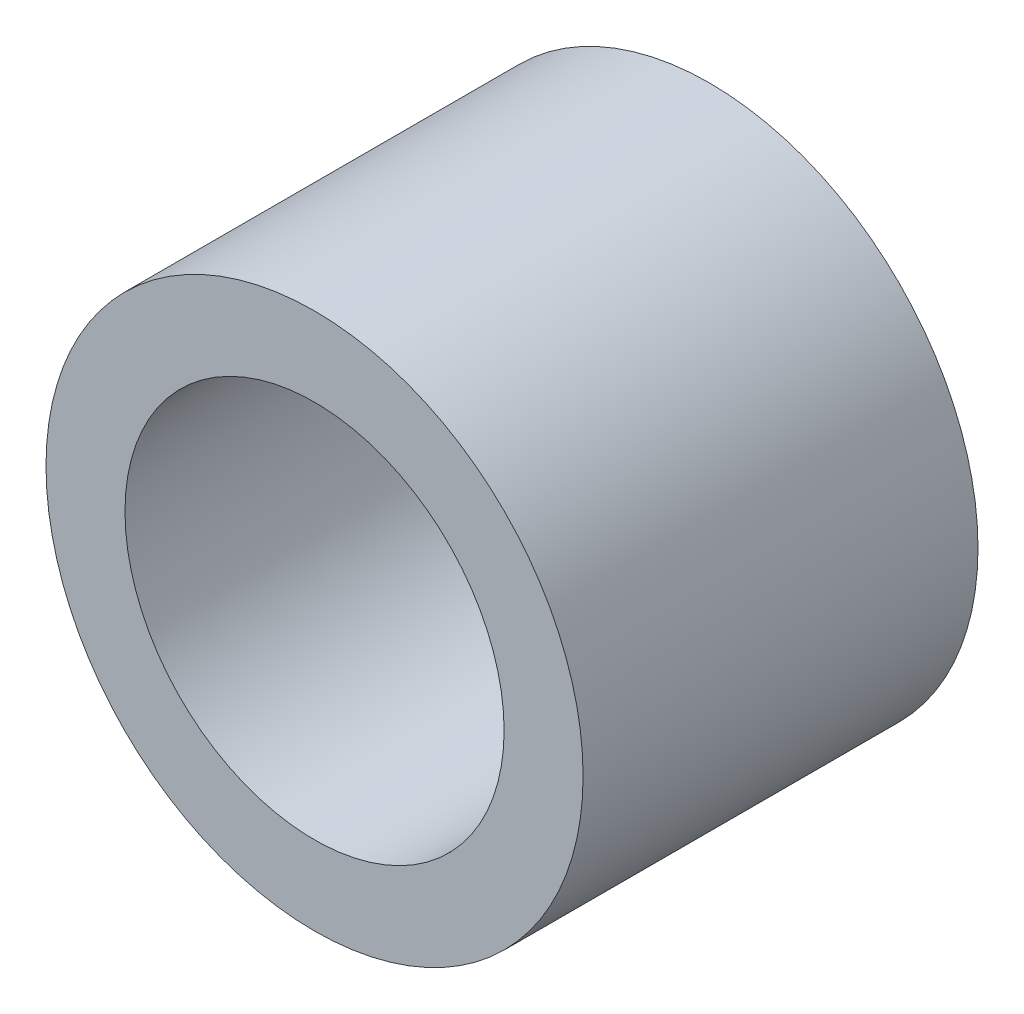
from build123d import *

# Parameters (mm, degrees)
SKETCH1_R           = 17
SKETCH1_R_2         = 12
BOSS_EXTRUDE1_DEPTH = 25


with BuildPart() as part:
    # Sketch1 → Boss-Extrude1 (new body)
    with BuildSketch(Plane.XY):
        with Locations(Location((0, 0, 0), (0, 0, 180))):
            Circle(SKETCH1_R)
        with Locations(Location((0, 0, 0), (0, 0, 180))):
            Circle(SKETCH1_R_2, mode=Mode.SUBTRACT)
    extrude(amount=BOSS_EXTRUDE1_DEPTH)


solid = part.part
